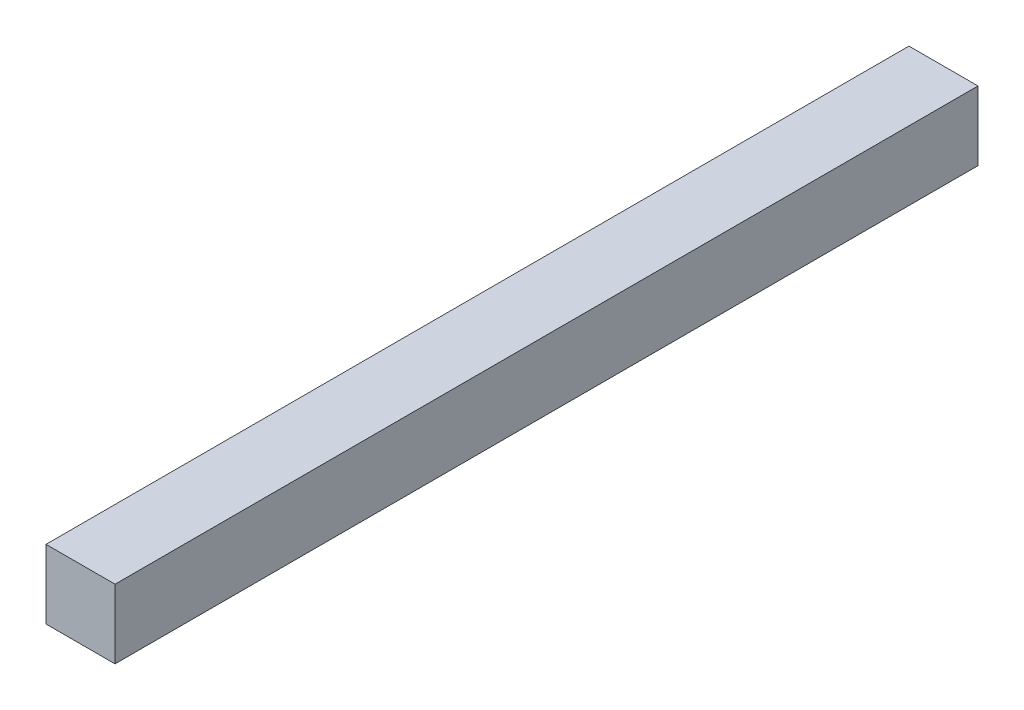
from build123d import *

# Parameters (mm, degrees)
SKETCH1_W           = 20
SKETCH1_H           = 20
BOSS_EXTRUDE1_DEPTH = 250


with BuildPart() as part:
    # Sketch1 → Boss-Extrude1 (new body)
    with BuildSketch(Plane.XY):
        Rectangle(SKETCH1_W, SKETCH1_H)
    extrude(amount=BOSS_EXTRUDE1_DEPTH)


solid = part.part
